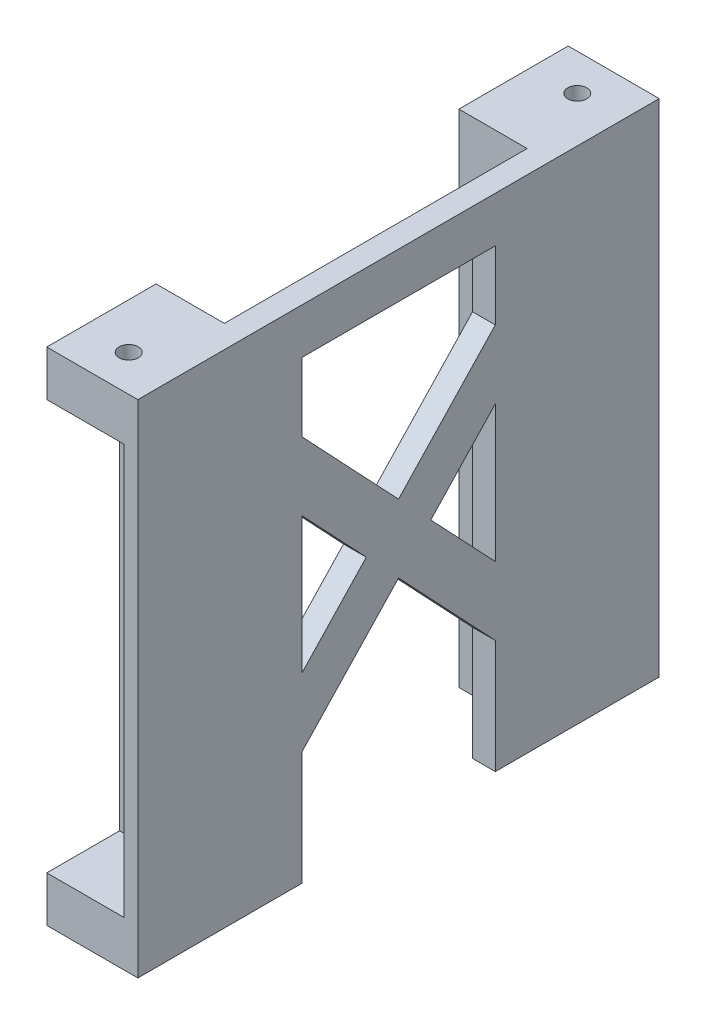
from build123d import *

# Parameters (mm, degrees)
SKETCH_1_R      = 2.1
EXTRUDE_1_DEPTH = 10
EXTRUDE_2_DEPTH = 90
SKETCH_3_R      = 2.1
EXTRUDE_3_DEPTH = 10
EXTRUDE_4_DEPTH = 90
EXTRUDE_5_DEPTH = 5
SKETCH_6_R      = 2.1
EXTRUDE_6_DEPTH = 10


with BuildPart() as part:
    # Эскиз1 → Бобышка-Вытянуть1 (new body)
    with BuildSketch(Plane(origin=(0, 139.195974268, 0), x_dir=(1, 0, 0), z_dir=(0, 1, 0))):
        Polygon((108.058980694, -32.273129836), (128.058980694, -32.273129836), (128.058980694, -68.273129836), (123.058980694, -68.273129836), (123.058980694, -56.273129836), (108.058980694, -56.273129836), align=None)
        with Locations(Location((120.058980694, -40.273129836, 0), (0, 0, 180))):
            Circle(SKETCH_1_R, mode=Mode.SUBTRACT)
    extrude(amount=EXTRUDE_1_DEPTH)

    # Эскиз2 → Бобышка-Вытянуть2 (add)
    with BuildSketch(Plane(origin=(0, 149.195974268, 0), x_dir=(1, 0, 0), z_dir=(0, 1, 0))):
        Polygon((128.058980694, -32.273129836), (125.058980694, -32.273129836), (125.058980694, -48.273129836), (108.058980694, -48.273129836), (108.058980694, -56.273129836), (123.058980694, -56.273129836), (123.058980694, -68.273129836), (128.058980694, -68.273129836), align=None)
    extrude(amount=EXTRUDE_2_DEPTH)



with BuildPart() as body_2:
    # Эскиз3 → Бобышка-Вытянуть3 (new body)
    with BuildSketch(Plane(origin=(0, 139.195974268, 0), x_dir=(1, 0, 0), z_dir=(0, 1, 0))):
        Polygon((123.058980694, -110.773129836), (123.058980694, -122.773129836), (108.058980694, -122.773129836), (108.058980694, -146.773129836), (128.058980694, -146.773129836), (128.058980694, -110.773129836), align=None)
        with Locations(Location((120.058980694, -138.773129836, 0), (0, 0, 180))):
            Circle(SKETCH_3_R, mode=Mode.SUBTRACT)
    extrude(amount=EXTRUDE_3_DEPTH)

    # Эскиз4 → Бобышка-Вытянуть4 (add)
    with BuildSketch(Plane(origin=(0, 149.195974268, 0), x_dir=(1, 0, 0), z_dir=(0, 1, 0))):
        Polygon((123.058980694, -110.773129836), (123.058980694, -122.773129836), (108.058980694, -122.773129836), (108.058980694, -130.773129836), (125.058980694, -130.773129836), (125.058980694, -146.773129836), (128.058980694, -146.773129836), (128.058980694, -110.773129836), align=None)
    extrude(amount=EXTRUDE_4_DEPTH)


with BuildPart() as part_1:
    add(part.part)

    add(body_2.part)  # Бобышка-Вытянуть5 merges body 2
    # Эскиз5 → Бобышка-Вытянуть5 (add)
    with BuildSketch(Plane(origin=(128.058980694, 0, 0), x_dir=(0, 0, -1), z_dir=(1, 0, 0))):
        Polygon((-68.273129836, 224.145974268), (-68.273129836, 209.145974268), (-82.439796503, 194.145974268), (-68.273129836, 179.145974268), (-68.273129836, 164.145974268), (-89.523129836, 186.645974268), (-110.773129836, 164.145974268), (-110.773129836, 179.145974268), (-96.60646317, 194.145974268), (-110.773129836, 209.145974268), (-110.773129836, 224.145974268), (-89.523129836, 201.645974268), align=None)
    extrude(amount=-EXTRUDE_5_DEPTH)

    # Эскиз6 → Бобышка-Вытянуть6 (add)
    with BuildSketch(Plane(origin=(0, 239.195974268, 0), x_dir=(1, 0, 0), z_dir=(0, 1, 0))):
        Polygon((108.058980694, -56.273129836), (108.058980694, -32.273129836), (128.058980694, -32.273129836), (128.058980694, -146.773129836), (108.058980694, -146.773129836), (108.058980694, -122.773129836), (123.058980694, -122.773129836), (123.058980694, -56.273129836), align=None)
        with Locations(Location((118.058980694, -40.273129836, 0), (0, 0, 180))):
            Circle(SKETCH_6_R, mode=Mode.SUBTRACT)
        with Locations(Location((118.058980694, -138.773129836, 0), (0, 0, 180))):
            Circle(SKETCH_6_R, mode=Mode.SUBTRACT)
    extrude(amount=EXTRUDE_6_DEPTH)


solid = part_1.part
